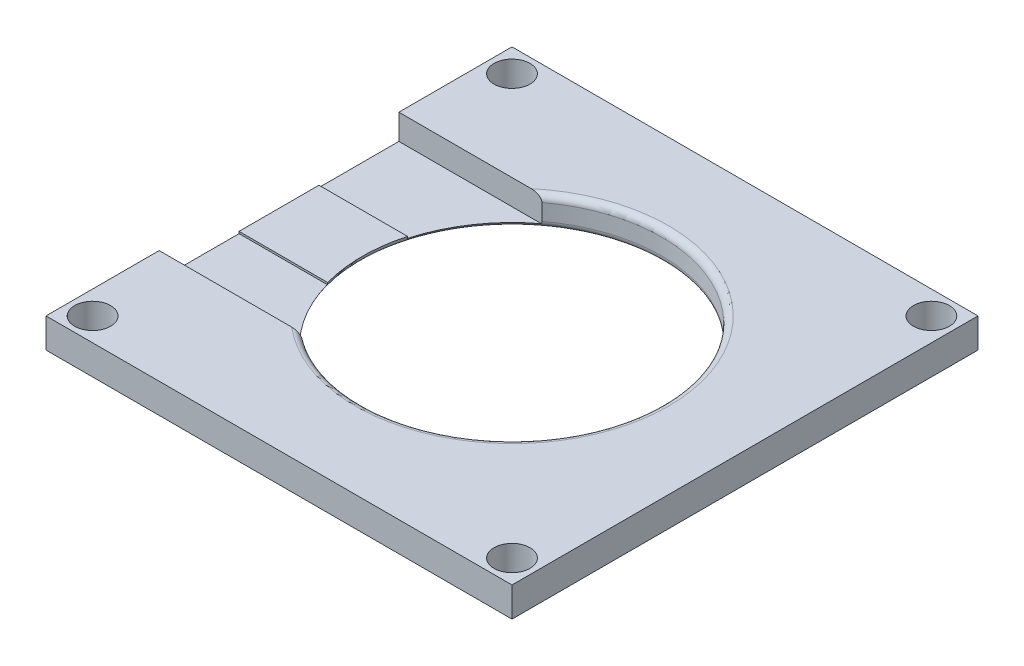
from build123d import *

# Parameters (mm, degrees)
SKETCH1_W           = 70
SKETCH1_H           = 70
SKETCH1_R           = 2.7
BOSS_EXTRUDE1_DEPTH = 4.45
SKETCH2_R           = 22.5
CUT_EXTRUDE1_DEPTH  = 50.697107562
FILLET1_R           = 1
SKETCH4_W           = 10
SKETCH4_H           = 12
CUT_EXTRUDE3_DEPTH  = 3.5
FILLET2_R           = 1
FILLET3_R           = 1
CUT_EXTRUDE4_DEPTH  = 27.5
CUT_EXTRUDE5_DEPTH  = 14.5


with BuildPart() as part:
    # Sketch1 → Boss-Extrude1 (new body)
    with BuildSketch(Plane(origin=(0, 0, 0), x_dir=(1, 0, 0), z_dir=(0, 1, 0))):
        Rectangle(SKETCH1_W, SKETCH1_H)
        with Locations(Location((31.5, 31.5, 0), (0, 0, 270))):
            Circle(SKETCH1_R, mode=Mode.SUBTRACT)
        with Locations(Location((-31.5, 31.5, 0), (0, 0, 270))):
            Circle(SKETCH1_R, mode=Mode.SUBTRACT)
        with Locations(Location((31.5, -31.5, 0), (0, 0, 270))):
            Circle(SKETCH1_R, mode=Mode.SUBTRACT)
        with Locations(Location((-31.5, -31.5, 0), (0, 0, 270))):
            Circle(SKETCH1_R, mode=Mode.SUBTRACT)
    extrude(amount=BOSS_EXTRUDE1_DEPTH)

    # Sketch2 → Cut-Extrude1 (cut, through all)
    with BuildSketch(Plane(origin=(0, 4.45, 0), x_dir=(1, 0, 0), z_dir=(0, 1, 0))):
        with Locations(Location((0, 0, 0), (0, 0, 270))):
            Circle(SKETCH2_R)
    extrude(amount=-CUT_EXTRUDE1_DEPTH, mode=Mode.SUBTRACT)

    # Fillet1
    fillet1_edges = [part.edges().sort_by_distance(p)[0] for p in [
        (0, 4.45, -22.5),
    ]]
    fillet(fillet1_edges, radius=FILLET1_R)

    # Sketch4 → Cut-Extrude3 (cut)
    with BuildSketch(Plane(origin=(0, 4.45, 0), x_dir=(1, 0, 0), z_dir=(0, 1, 0))):
        with Locations((-30, 0)):
            Rectangle(SKETCH4_W, SKETCH4_H)
    extrude(amount=-CUT_EXTRUDE3_DEPTH, mode=Mode.SUBTRACT)

    # Fillet2
    fillet2_edges = [part.edges().sort_by_distance(p)[0] for p in [
        (0, 0, -22.5),
    ]]
    fillet(fillet2_edges, radius=FILLET2_R)

    # Fillet3
    fillet3_edges = [part.edges().sort_by_distance(p)[0] for p in [
        (-30, 4.45, -6),
        (-30, 4.45, 6),
    ]]
    fillet(fillet3_edges, radius=FILLET3_R)

    # Sketch6 → Cut-Extrude4 (cut)
    with BuildSketch(Plane.ZY.offset(35)):
        with BuildLine():
            Line((7, 4.45), (18, 4.45))
            Line((18, 4.45), (18, 0.65))
            Line((18, 0.65), (6, 0.65))
            Line((6, 0.65), (6, 3.45))
            ThreePointArc((6, 3.45), (6.292893219, 4.157106781), (7, 4.45))
        make_face()
        with BuildLine():
            Line((-7, 4.45), (-18, 4.45))
            Line((-18, 4.45), (-18, 0.65))
            Line((-18, 0.65), (-6, 0.65))
            Line((-6, 0.65), (-6, 3.45))
            ThreePointArc((-6, 3.45), (-6.292893219, 4.157106781), (-7, 4.45))
        make_face()
    extrude(amount=-CUT_EXTRUDE4_DEPTH, mode=Mode.SUBTRACT)

    # Sketch7 → Cut-Extrude5 (cut)
    with BuildSketch(Plane.ZY.offset(25)):
        with BuildLine():
            Line((7, 4.45), (-7, 4.45))
            ThreePointArc((-7, 4.45), (-6.292893219, 4.157106781), (-6, 3.45))
            Line((-6, 3.45), (-6, 0.95))
            Line((-6, 0.95), (6, 0.95))
            Line((6, 0.95), (6, 3.45))
            ThreePointArc((6, 3.45), (6.292893219, 4.157106781), (7, 4.45))
        make_face()
    extrude(amount=-CUT_EXTRUDE5_DEPTH, mode=Mode.SUBTRACT)


with BuildPart() as cut_extrude5_kept_piece:
    # of the separate pieces the step leaves, the one the design keeps (cut_extrude5_pieces_kept)
    add(part.part.solids().sort_by_distance((-35, 4.45, 18))[0])


solid = cut_extrude5_kept_piece.part
